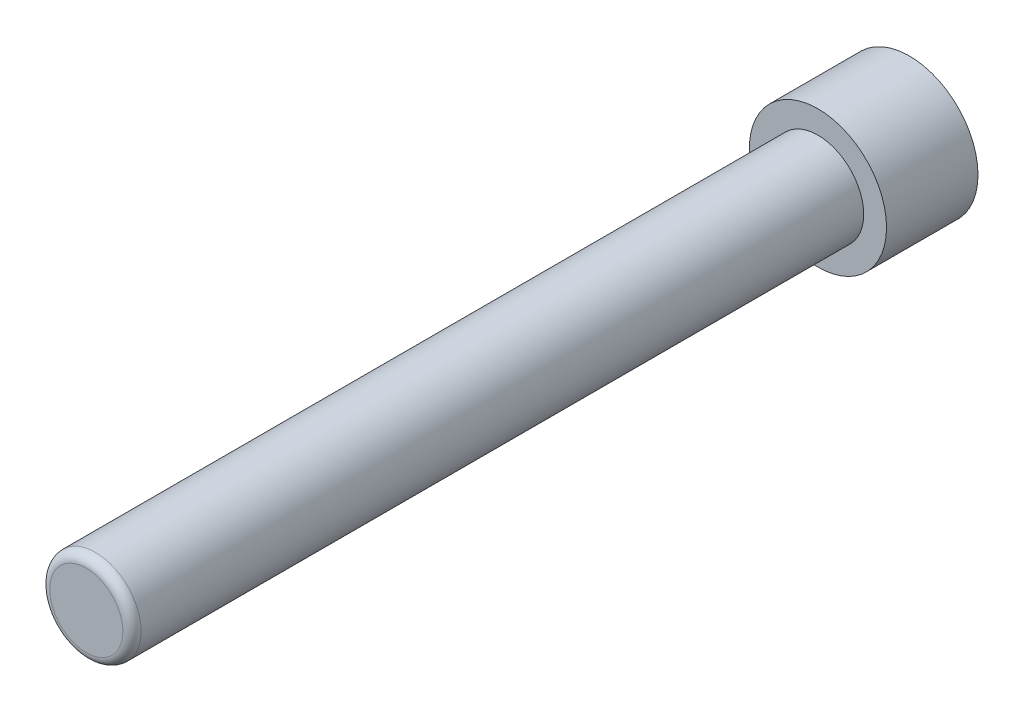
from build123d import *

# Parameters (mm, degrees)
SKETCH1_R           = 19.05
BOSS_EXTRUDE1_DEPTH = 25.4
SKETCH2_R           = 12.7
BOSS_EXTRUDE2_DEPTH = 203.2
FILLET1_R           = 2.54


with BuildPart() as part:
    # Sketch1 → Boss-Extrude1 (new body)
    with BuildSketch(Plane.XY):
        Circle(SKETCH1_R)
    extrude(amount=BOSS_EXTRUDE1_DEPTH)

    # Sketch2 → Boss-Extrude2 (add)
    with BuildSketch(Plane.XY.offset(25.4)):
        Circle(SKETCH2_R)
    extrude(amount=BOSS_EXTRUDE2_DEPTH)

    # Fillet1
    fillet1_edges = [part.edges().sort_by_distance(p)[0] for p in [
        (-12.7, 0, 228.6),
    ]]
    fillet(fillet1_edges, radius=FILLET1_R)


solid = part.part
